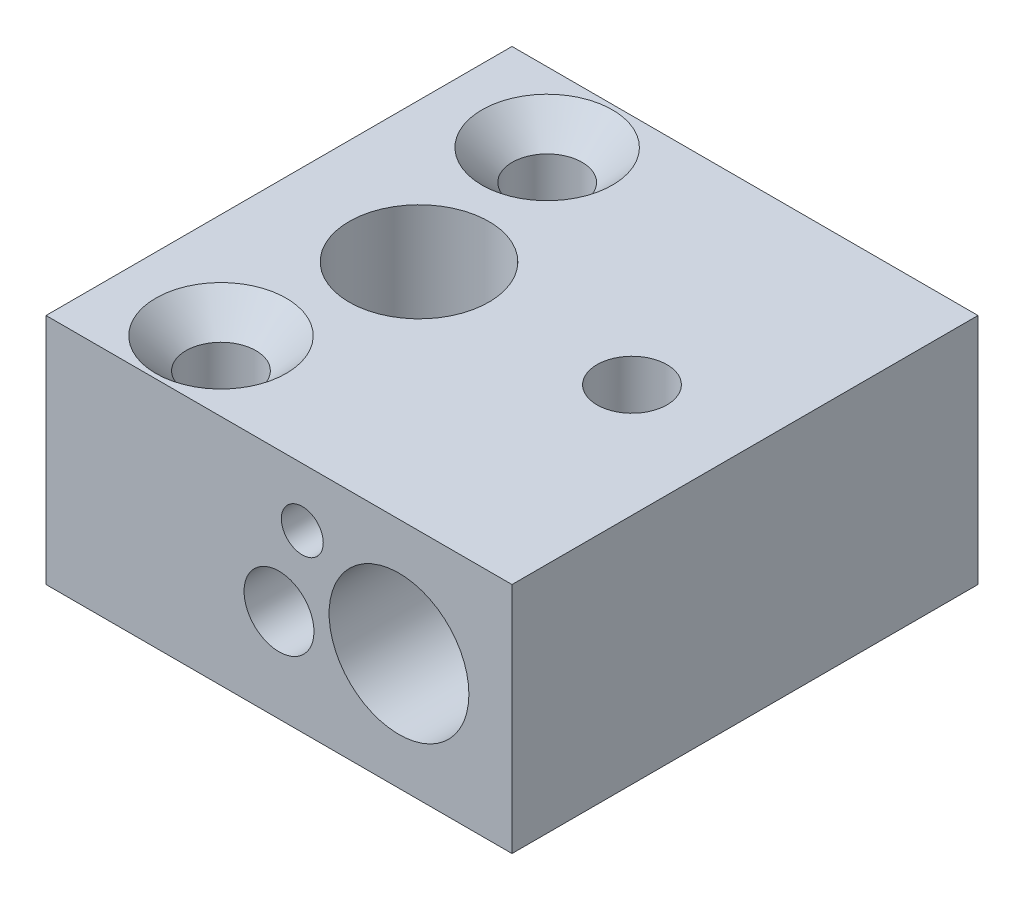
from build123d import *

# Parameters (mm, degrees)
SKETCH1_W                                       = 20
SKETCH1_H                                       = 20
BOSS_EXTRUDE1_DEPTH                             = 10
F_6_0MM_DOWEL_HOLE2_D                           = 6
CSK_FOR_M3_FLAT_HEAD_MACHINE_SCREW1_D           = 3
CSK_FOR_M3_FLAT_HEAD_MACHINE_SCREW1_CSINK_D     = 5.6
CSK_FOR_M3_FLAT_HEAD_MACHINE_SCREW1_CSINK_ANGLE = 90
F_6_0MM_DOWEL_HOLE3_D                           = 6
F_3_0MM_DOWEL_HOLE1_REACH                       = 32
F_3_0MM_DOWEL_HOLE1_BORE_R                      = 1.5
F_3_0MM_DOWEL_HOLE2_D                           = 3
F_3_0MM_DOWEL_HOLE2_DEPTH                       = 6
F_3_0MM_DOWEL_HOLE2_TIP                         = 0.901290929
F_1_5MM_DOWEL_HOLE1_D                           = 1.8
F_1_5MM_DOWEL_HOLE1_DEPTH                       = 4
F_1_5MM_DOWEL_HOLE1_TIP                         = 0.540774557


with BuildPart() as part:
    # Sketch1 → Boss-Extrude1 (new body)
    with BuildSketch(Plane(origin=(0, 0, 0), x_dir=(1, 0, 0), z_dir=(0, 1, 0))):
        with Locations((10, 10)):
            Rectangle(SKETCH1_W, SKETCH1_H)
    extrude(amount=BOSS_EXTRUDE1_DEPTH)

    # Ø6.0mm Dowel Hole2 (through all)
    with Locations(Plane(origin=(0, 10, 0), x_dir=(1, 0, 0), z_dir=(0, 1, 0))):
        with Locations((6.01, 10)):
            Hole(F_6_0MM_DOWEL_HOLE2_D / 2)

    # CSK for M3 Flat Head Machine Screw1 (through all)
    with Locations(Plane(origin=(0, 10, 0), x_dir=(1, 0, 0), z_dir=(0, 1, 0))):
        with Locations((4.51, 3), (4.51, 17)):
            CounterSinkHole(CSK_FOR_M3_FLAT_HEAD_MACHINE_SCREW1_D / 2, CSK_FOR_M3_FLAT_HEAD_MACHINE_SCREW1_CSINK_D / 2, counter_sink_angle=CSK_FOR_M3_FLAT_HEAD_MACHINE_SCREW1_CSINK_ANGLE)

    # Ø6.0mm Dowel Hole3 (through all)
    with Locations(Plane.XY):
        with Locations((15.15, 5)):
            Hole(F_6_0MM_DOWEL_HOLE3_D / 2)

    # Ø3.0mm Dowel Hole1 bore → Ø3.0mm Dowel Hole1 (cut, up to next)
    with BuildSketch(Plane(origin=(0, 10, 0), x_dir=(1, 0, 0), z_dir=(0, 1, 0)), mode=Mode.PRIVATE) as f_3_0mm_dowel_hole1_sk1:
        with Locations((15.15, 10)):
            Circle(F_3_0MM_DOWEL_HOLE1_BORE_R)
    f_3_0mm_dowel_hole1_tool1 = extrude(f_3_0mm_dowel_hole1_sk1.sketch, amount=-F_3_0MM_DOWEL_HOLE1_REACH, mode=Mode.PRIVATE) & part.part
    add(f_3_0mm_dowel_hole1_tool1.solids().sort_by_distance((15.15, 10, -10))[0], mode=Mode.SUBTRACT)

    # Ø3.0mm Dowel Hole2
    with Locations(Plane.XY):
        with Locations((10, 4)):
            Hole(F_3_0MM_DOWEL_HOLE2_D / 2, depth=F_3_0MM_DOWEL_HOLE2_DEPTH)
            with Locations((0, 0, -(F_3_0MM_DOWEL_HOLE2_DEPTH + F_3_0MM_DOWEL_HOLE2_TIP / 2))):  # 118° drill point
                Cone(0, F_3_0MM_DOWEL_HOLE2_D / 2, F_3_0MM_DOWEL_HOLE2_TIP, mode=Mode.SUBTRACT)

    # Ø1.5mm Dowel Hole1
    with Locations(Plane.XY):
        with Locations((11, 7.5)):
            Hole(F_1_5MM_DOWEL_HOLE1_D / 2, depth=F_1_5MM_DOWEL_HOLE1_DEPTH)
            with Locations((0, 0, -(F_1_5MM_DOWEL_HOLE1_DEPTH + F_1_5MM_DOWEL_HOLE1_TIP / 2))):  # 118° drill point
                Cone(0, F_1_5MM_DOWEL_HOLE1_D / 2, F_1_5MM_DOWEL_HOLE1_TIP, mode=Mode.SUBTRACT)


solid = part.part
